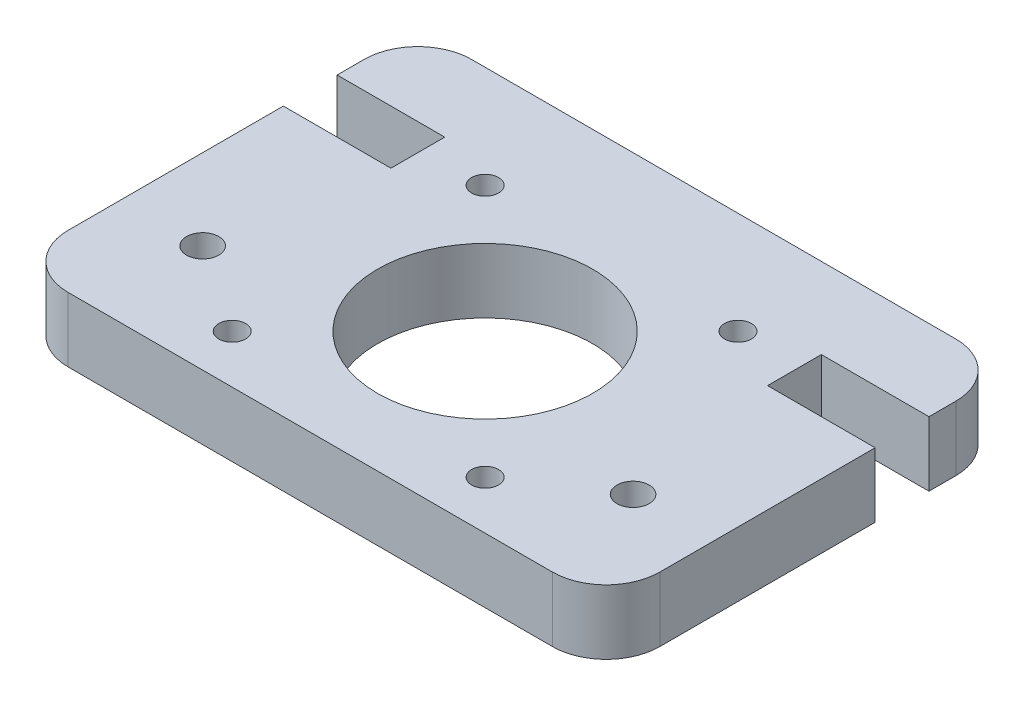
from build123d import *

# Parameters (mm, degrees)
SKETCH1_R           = 3
SKETCH1_R_2         = 2.5
SKETCH1_R_3         = 20
BOSS_EXTRUDE1_DEPTH = 12
CUT_EXTRUDE1_DEPTH  = 6


with BuildPart() as part:
    # Sketch1 → Boss-Extrude1 (new body)
    with BuildSketch(Plane(origin=(0, 0, 0), x_dir=(1, 0, 0), z_dir=(0, 1, 0))):
        with BuildLine():
            Line((10, 0), (100, 0))
            ThreePointArc((100, 0), (107.071067812, 2.928932188), (110, 10))
            Line((110, 10), (110, 50))
            Line((110, 50), (90, 50))
            Line((90, 50), (90, 60))
            Line((90, 60), (110, 60))
            Line((110, 60), (110, 65))
            ThreePointArc((110, 65), (107.071067812, 72.071067812), (100, 75))
            Line((100, 75), (10, 75))
            ThreePointArc((10, 75), (2.928932188, 72.071067812), (0, 65))
            Line((0, 65), (0, 60))
            Line((0, 60), (20, 60))
            Line((20, 60), (20, 50))
            Line((20, 50), (0, 50))
            Line((0, 50), (0, 10))
            ThreePointArc((0, 10), (2.928932188, 2.928932188), (10, 0))
        make_face()
        with Locations(Location((15, 20, 0), (0, 0, 270))):
            Circle(SKETCH1_R, mode=Mode.SUBTRACT)
        with Locations(Location((78.5, 56, 0), (0, 0, 270))):
            Circle(SKETCH1_R_2, mode=Mode.SUBTRACT)
        with Locations(Location((95, 20, 0), (0, 0, 90))):
            Circle(SKETCH1_R, mode=Mode.SUBTRACT)
        with Locations(Location((55, 32.5, 0), (0, 0, 270))):
            Circle(SKETCH1_R_3, mode=Mode.SUBTRACT)
        with Locations(Location((31.5, 56, 0), (0, 0, 90))):
            Circle(SKETCH1_R_2, mode=Mode.SUBTRACT)
        with Locations(Location((78.5, 9, 0), (0, 0, 90))):
            Circle(SKETCH1_R_2, mode=Mode.SUBTRACT)
        with Locations(Location((31.5, 9, 0), (0, 0, 270))):
            Circle(SKETCH1_R_2, mode=Mode.SUBTRACT)
    extrude(amount=BOSS_EXTRUDE1_DEPTH)

    # Sketch2 → Cut-Extrude1 (cut)
    with BuildSketch(Plane.XZ):
        Polygon((29.046261356, -51.75), (26.592522712, -56), (29.046261356, -60.25), (33.953738644, -60.25), (36.407477288, -56), (33.953738644, -51.75), align=None)
        Polygon((76.046261356, -51.75), (73.592522712, -56), (76.046261356, -60.25), (80.953738644, -60.25), (83.407477288, -56), (80.953738644, -51.75), align=None)
    extrude(amount=-CUT_EXTRUDE1_DEPTH, mode=Mode.SUBTRACT)


solid = part.part
